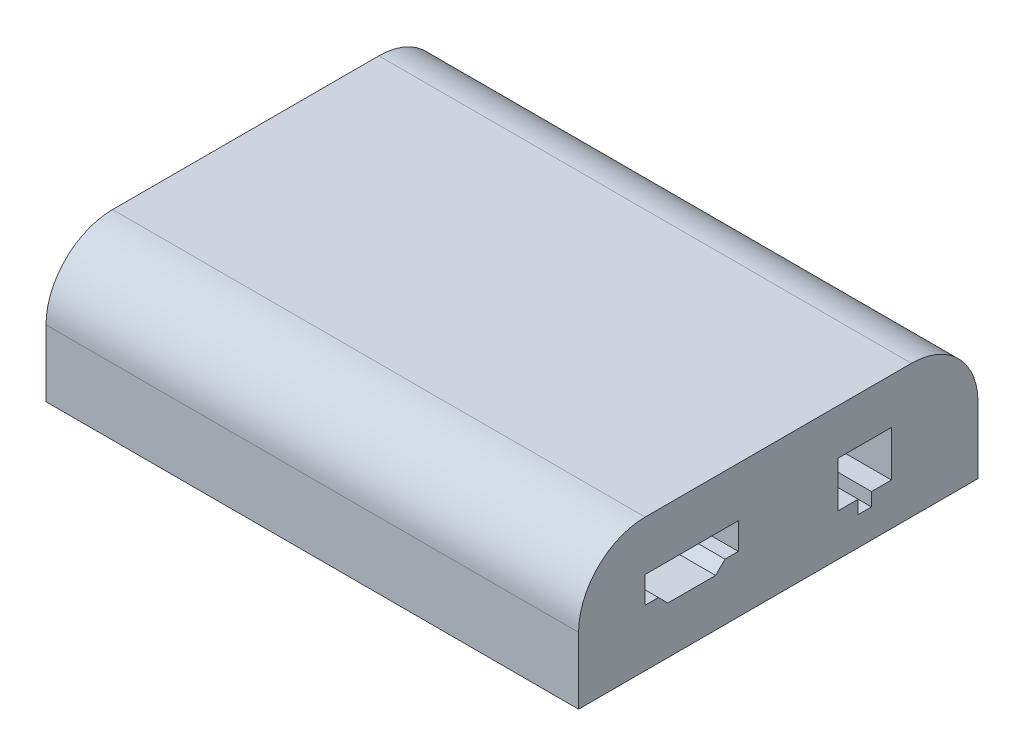
from build123d import *

# Parameters (mm, degrees)
CROQUIS1_W              = 80
CROQUIS1_H              = 60
SALIENTE_EXTRUIR1_DEPTH = 20
CORTAR_EXTRUIR1_DEPTH   = 20
REDONDEO1_R             = 10
CORTAR_EXTRUIR2_DEPTH   = 20


with BuildPart() as part:
    # Croquis1 → Saliente-Extruir1 (new body)
    with BuildSketch(Plane(origin=(0, 0, 0), x_dir=(1, 0, 0), z_dir=(0, 1, 0))):
        with Locations((40, 30)):
            Rectangle(CROQUIS1_W, CROQUIS1_H)
    extrude(amount=SALIENTE_EXTRUIR1_DEPTH)

    # Croquis2 → Cortar-Extruir1 (cut)
    with BuildSketch(Plane(origin=(80, 0, 0), x_dir=(0, 0, -1), z_dir=(1, 0, 0))):
        Polygon((10, 12.52909884), (10, 8.52909884), (12, 8.52909884), (13.414213562, 7.114885277), (20.585786438, 7.114885277), (22, 8.52909884), (24, 8.52909884), (24, 12.52909884), align=None)
        Polygon((43.998137674, 6.318837227), (47, 6.318837227), (47, 13.165528149), (39, 13.165528149), (39, 6.318837227), (42.001862326, 6.318837227), (42.001862326, 4.318837227), (43.998137674, 4.318837227), align=None)
    extrude(amount=-CORTAR_EXTRUIR1_DEPTH, mode=Mode.SUBTRACT)

    # Redondeo1
    redondeo1_edges = [part.edges().sort_by_distance(p)[0] for p in [
        (40, 20, -60),
        (40, 20, 0),
    ]]
    fillet(redondeo1_edges, radius=REDONDEO1_R)

    # Croquis3 → Cortar-Extruir2 (cut)
    with BuildSketch(Plane.ZY):
        Polygon((-10, 12.52909884), (-24, 12.52909884), (-24, 8.52909884), (-22, 8.52909884), (-20.585786438, 7.114885277), (-13.414213562, 7.114885277), (-12, 8.52909884), (-10, 8.52909884), align=None)
    extrude(amount=-CORTAR_EXTRUIR2_DEPTH, mode=Mode.SUBTRACT)


solid = part.part
